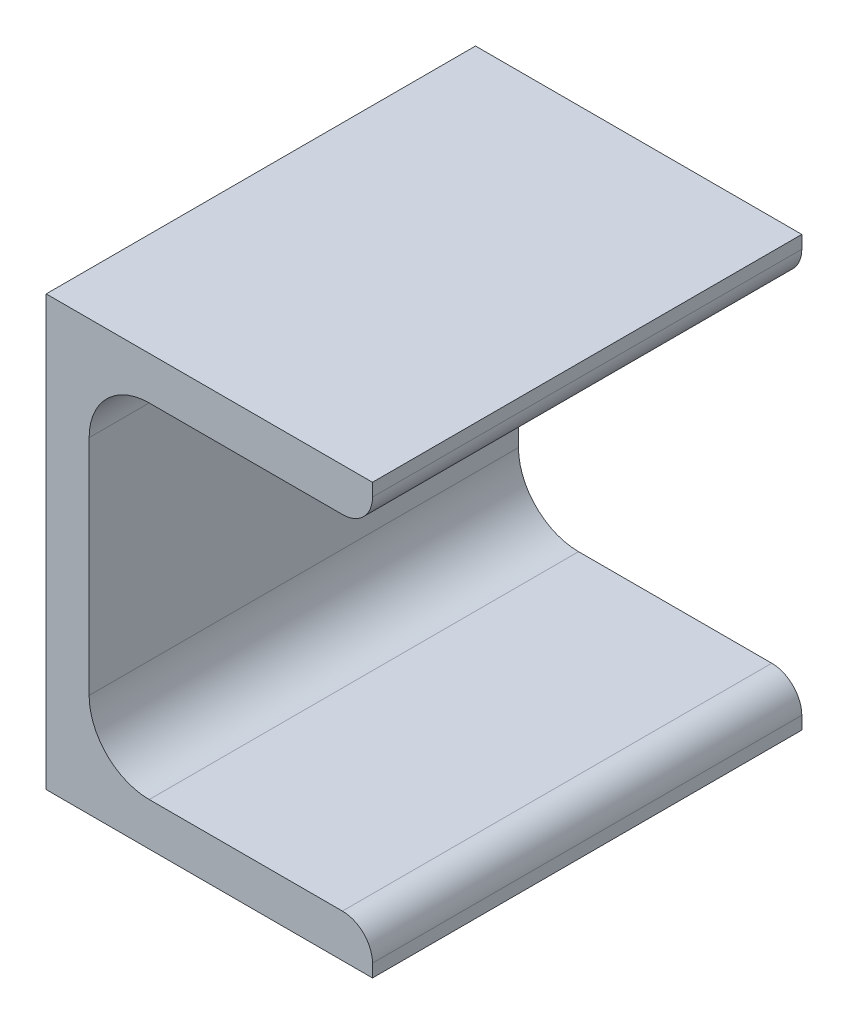
from build123d import *

# Parameters (mm, degrees)
DODANIE_WYCI_GNI_CIE1_DEPTH = 50


with BuildPart() as part:
    # Szkic1 → Dodanie-wyciągnięcie1 (new body)
    with BuildSketch(Plane.XY):
        with BuildLine():
            Line((0, 0), (0, -50))
            Line((0, -50), (38, -50))
            Line((38, -50), (38, -48.5))
            ThreePointArc((38, -48.5), (36.974873734, -46.025126266), (34.5, -45))
            Line((34.5, -45), (12, -45))
            ThreePointArc((12, -45), (7.050252532, -42.949747468), (5, -38))
            Line((5, -38), (5, -12))
            ThreePointArc((5, -12), (7.050252532, -7.050252532), (12, -5))
            Line((12, -5), (34.5, -5))
            ThreePointArc((34.5, -5), (36.974873734, -3.974873734), (38, -1.5))
            Line((38, -1.5), (38, 0))
            Line((38, 0), (0, 0))
        make_face()
    extrude(amount=DODANIE_WYCI_GNI_CIE1_DEPTH)


solid = part.part
